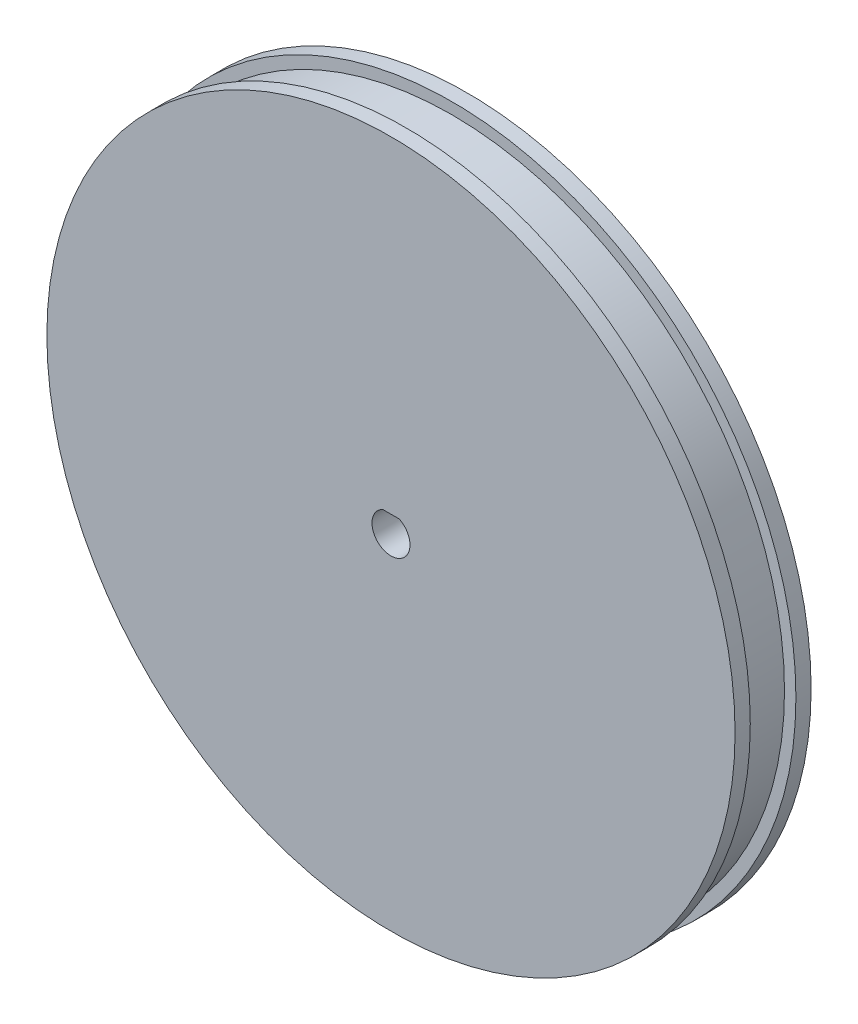
from build123d import *

# Parameters (mm, degrees)
SKIZZE2_R         = 43.75
ZAHNFL_CHE_DEPTH  = 6
SKIZZE4_R         = 45.25
SEITENTEIL1_DEPTH = 2
SEITENTEIL2_START = 2
SKIZZE5_R         = 45.25
SEITENTEIL2_DEPTH = 2
AUSSPARUNG_DEPTH  = 65.769784622


with BuildPart() as part:
    # Skizze2 → Zahnfläche (new body)
    with BuildSketch(Plane.XY):
        Circle(SKIZZE2_R)
    extrude(amount=ZAHNFL_CHE_DEPTH)

    # Skizze4 → Seitenteil1 (add)
    with BuildSketch(Plane(origin=(0, 0, 0), x_dir=(-1, 0, 0), z_dir=(0, 0, -1))):
        Circle(SKIZZE4_R)
    extrude(amount=SEITENTEIL1_DEPTH)

    # Skizze5 → Seitenteil2 (add)
    with BuildSketch(Plane.XY.offset(6).offset(SEITENTEIL2_START)):
        with Locations(Location((0, 0, 0), (0, 0, 180))):
            Circle(SKIZZE5_R)
    extrude(amount=-SEITENTEIL2_DEPTH)

    # Skizze6 → Aussparung (cut, through all)
    with BuildSketch(Plane.XY.offset(8)):
        with BuildLine():
            Line((-1.089724736, 2.25), (1.089724736, 2.25))
            ThreePointArc((1.089724736, 2.25), (0, -2.5), (-1.089724736, 2.25))
        make_face()
    extrude(amount=-AUSSPARUNG_DEPTH, mode=Mode.SUBTRACT)


solid = part.part
